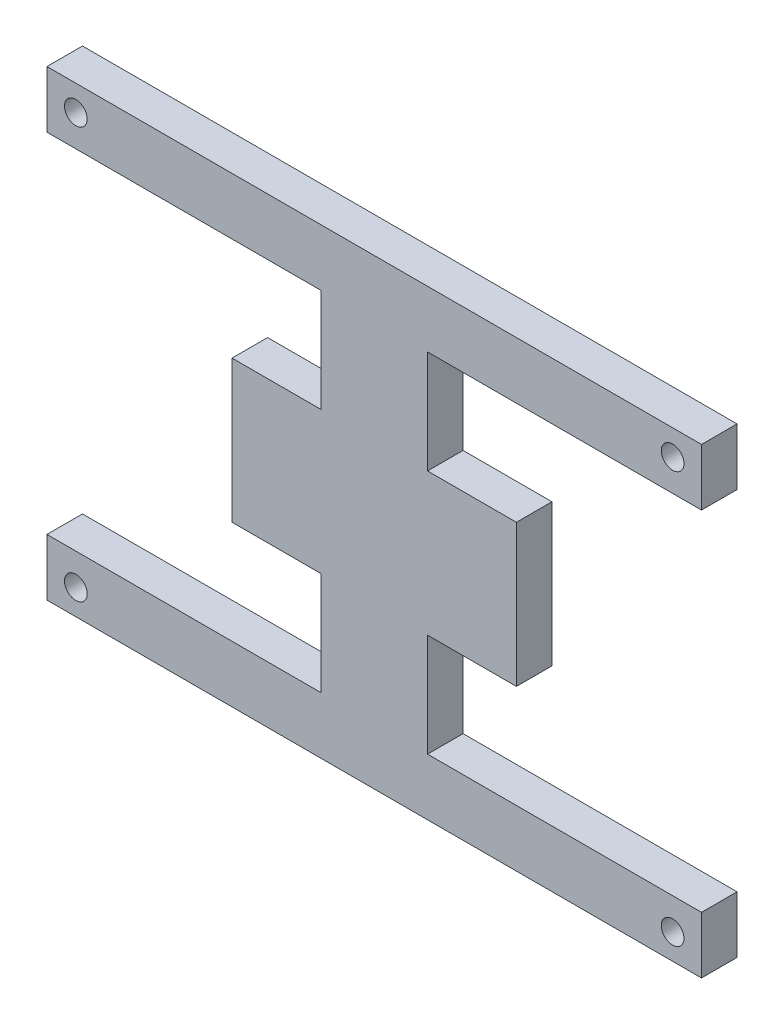
from build123d import *

# Parameters (mm, degrees)
SKETCH_1_W      = 92.075
SKETCH_1_H      = 8
SKETCH_1_R      = 1.6
SKETCH_1_W_2    = 12.5
SKETCH_1_H_2    = 20
SKETCH_1_W_3    = 15
SKETCH_1_H_3    = 14.5
EXTRUDE_1_DEPTH = 5


with BuildPart() as part:
    # 草图1 → 凸台-拉伸1 (new body)
    # profile 1 of 7: a face of its own
    with BuildSketch(Plane.XY):
        with Locations((0, 28.5)):
            Rectangle(SKETCH_1_W, SKETCH_1_H)
        with Locations((41.9735, 28.92)):
            Circle(SKETCH_1_R, mode=Mode.SUBTRACT)
        with Locations((-41.9735, 28.92)):
            Circle(SKETCH_1_R, mode=Mode.SUBTRACT)
    # profile 2 of 7: a face of its own
    with BuildSketch(Plane.XY):
        with Locations((13.75, 0)):
            Rectangle(SKETCH_1_W_2, SKETCH_1_H_2)
    # profile 3 of 7: a face of its own
    with BuildSketch(Plane.XY):
        Rectangle(SKETCH_1_W_3, SKETCH_1_H_2)
    # profile 4 of 7: a face of its own
    with BuildSketch(Plane.XY):
        with Locations((-13.75, 0)):
            Rectangle(SKETCH_1_W_2, SKETCH_1_H_2)
    # profile 5 of 7: a face of its own
    with BuildSketch(Plane.XY):
        with Locations((0, 17.25)):
            Rectangle(SKETCH_1_W_3, SKETCH_1_H_3)
    # profile 6 of 7: a face of its own
    with BuildSketch(Plane.XY):
        with Locations((0, -28.5)):
            Rectangle(SKETCH_1_W, SKETCH_1_H)
        with Locations((-41.9735, -28.92)):
            Circle(SKETCH_1_R, mode=Mode.SUBTRACT)
        with Locations((41.9735, -28.92)):
            Circle(SKETCH_1_R, mode=Mode.SUBTRACT)
    # profile 7 of 7: a face of its own
    with BuildSketch(Plane.XY):
        with Locations((0, -17.25)):
            Rectangle(SKETCH_1_W_3, SKETCH_1_H_3)
    extrude(amount=EXTRUDE_1_DEPTH)


solid = part.part
